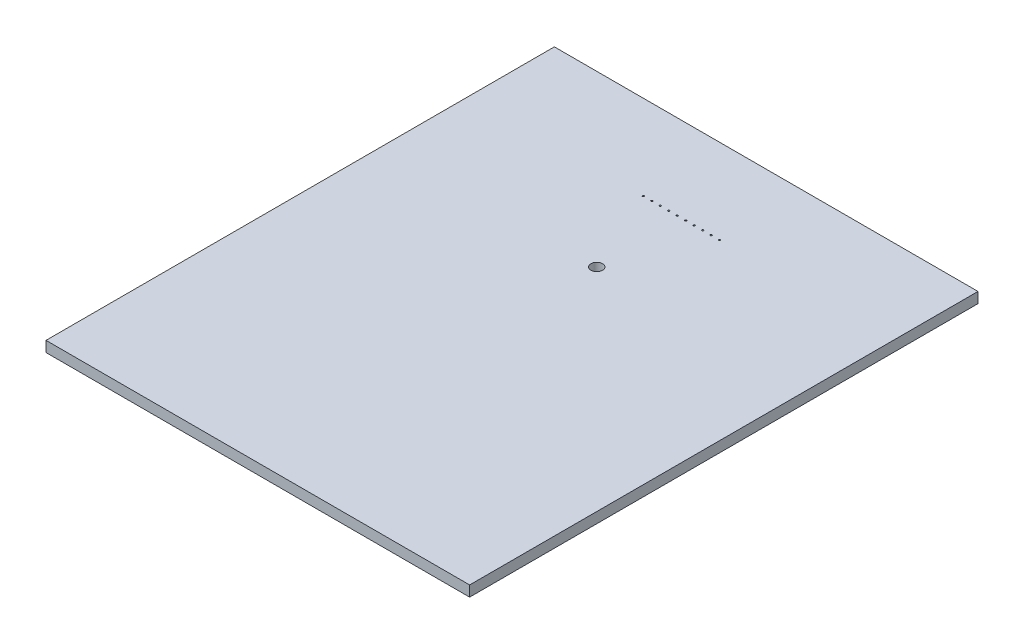
from build123d import *

# Parameters (mm, degrees)
SKETCH1_W             = 127
SKETCH1_H             = 152.4
BOSS_EXTRUDE1_DEPTH   = 3.175
F_8_32_TAPPED_HOLE2_D = 3.4544
SKETCH8_R             = 0.246300585
CUT_EXTRUDE1_DEPTH    = 199.40574746


with BuildPart() as part:
    # Sketch1 → Boss-Extrude1 (new body)
    with BuildSketch(Plane(origin=(0, 0, 0), x_dir=(1, 0, 0), z_dir=(0, 1, 0))):
        with Locations((63.5, 76.2)):
            Rectangle(SKETCH1_W, SKETCH1_H)
    extrude(amount=BOSS_EXTRUDE1_DEPTH)

    # #8-32 Tapped Hole2 (through all)
    with Locations(Plane(origin=(63.5, 3.175, -101.6), x_dir=(0, 0, 1), z_dir=(0, 1, 0))):
        with Locations((0, 0)):
            Hole(F_8_32_TAPPED_HOLE2_D / 2)

    # Sketch8 → Cut-Extrude1 (cut, through all)
    with BuildSketch(Plane(origin=(0, 3.175, 0), x_dir=(1, 0, 0), z_dir=(0, 1, 0))):
        with Locations(Location((52.07, 127, 0), (0, 0, 270))):
            Circle(SKETCH8_R)
        with Locations(Location((54.61, 127, 0), (0, 0, 270))):
            Circle(SKETCH8_R)
        with Locations(Location((57.15, 127, 0), (0, 0, 270))):
            Circle(SKETCH8_R)
        with Locations(Location((59.69, 127, 0), (0, 0, 270))):
            Circle(SKETCH8_R)
        with Locations(Location((62.23, 127, 0), (0, 0, 270))):
            Circle(SKETCH8_R)
        with Locations(Location((64.77, 127, 0), (0, 0, 270))):
            Circle(SKETCH8_R)
        with Locations(Location((67.31, 127, 0), (0, 0, 270))):
            Circle(SKETCH8_R)
        with Locations(Location((69.85, 127, 0), (0, 0, 270))):
            Circle(SKETCH8_R)
        with Locations(Location((72.39, 127, 0), (0, 0, 270))):
            Circle(SKETCH8_R)
        with Locations(Location((74.93, 127, 0), (0, 0, 270))):
            Circle(SKETCH8_R)
    extrude(amount=-CUT_EXTRUDE1_DEPTH, mode=Mode.SUBTRACT)


solid = part.part
